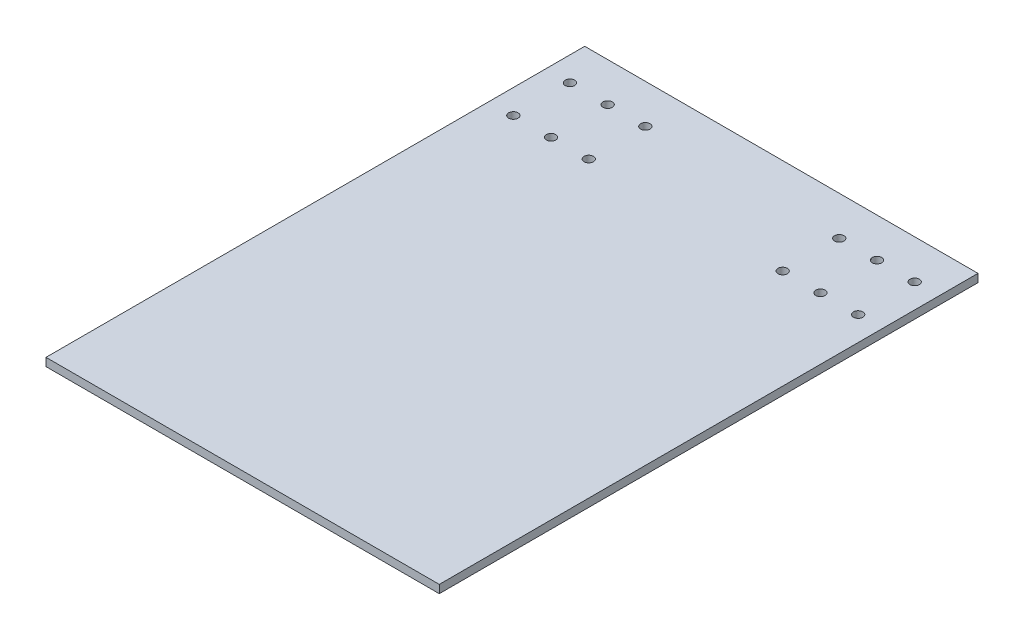
from build123d import *

# Parameters (mm, degrees)
SKETCH1_W           = 146
SKETCH1_H           = 200
SKETCH1_R           = 1.75
BOSS_EXTRUDE1_DEPTH = 3


with BuildPart() as part:
    # Sketch1 → Boss-Extrude1 (new body)
    with BuildSketch(Plane(origin=(0, 0, 0), x_dir=(1, 0, 0), z_dir=(0, 1, 0))):
        Rectangle(SKETCH1_W, SKETCH1_H)
        with Locations(Location((-64, 85.5, 0), (0, 0, 270))):
            Circle(SKETCH1_R, mode=Mode.SUBTRACT)
        with Locations(Location((-64, 64.5, 0), (0, 0, 90))):
            Circle(SKETCH1_R, mode=Mode.SUBTRACT)
        with Locations(Location((-50, 85.5, 0), (0, 0, 270))):
            Circle(SKETCH1_R, mode=Mode.SUBTRACT)
        with Locations(Location((-50, 64.5, 0), (0, 0, 90))):
            Circle(SKETCH1_R, mode=Mode.SUBTRACT)
        with Locations(Location((-36, 85.5, 0), (0, 0, 270))):
            Circle(SKETCH1_R, mode=Mode.SUBTRACT)
        with Locations(Location((-36, 64.5, 0), (0, 0, 90))):
            Circle(SKETCH1_R, mode=Mode.SUBTRACT)
        with Locations(Location((36, 64.5, 0), (0, 0, 270))):
            Circle(SKETCH1_R, mode=Mode.SUBTRACT)
        with Locations(Location((36, 85.5, 0), (0, 0, 90))):
            Circle(SKETCH1_R, mode=Mode.SUBTRACT)
        with Locations(Location((50, 64.5, 0), (0, 0, 270))):
            Circle(SKETCH1_R, mode=Mode.SUBTRACT)
        with Locations(Location((50, 85.5, 0), (0, 0, 90))):
            Circle(SKETCH1_R, mode=Mode.SUBTRACT)
        with Locations(Location((64, 64.5, 0), (0, 0, 270))):
            Circle(SKETCH1_R, mode=Mode.SUBTRACT)
        with Locations(Location((64, 85.5, 0), (0, 0, 90))):
            Circle(SKETCH1_R, mode=Mode.SUBTRACT)
    extrude(amount=BOSS_EXTRUDE1_DEPTH)


solid = part.part
